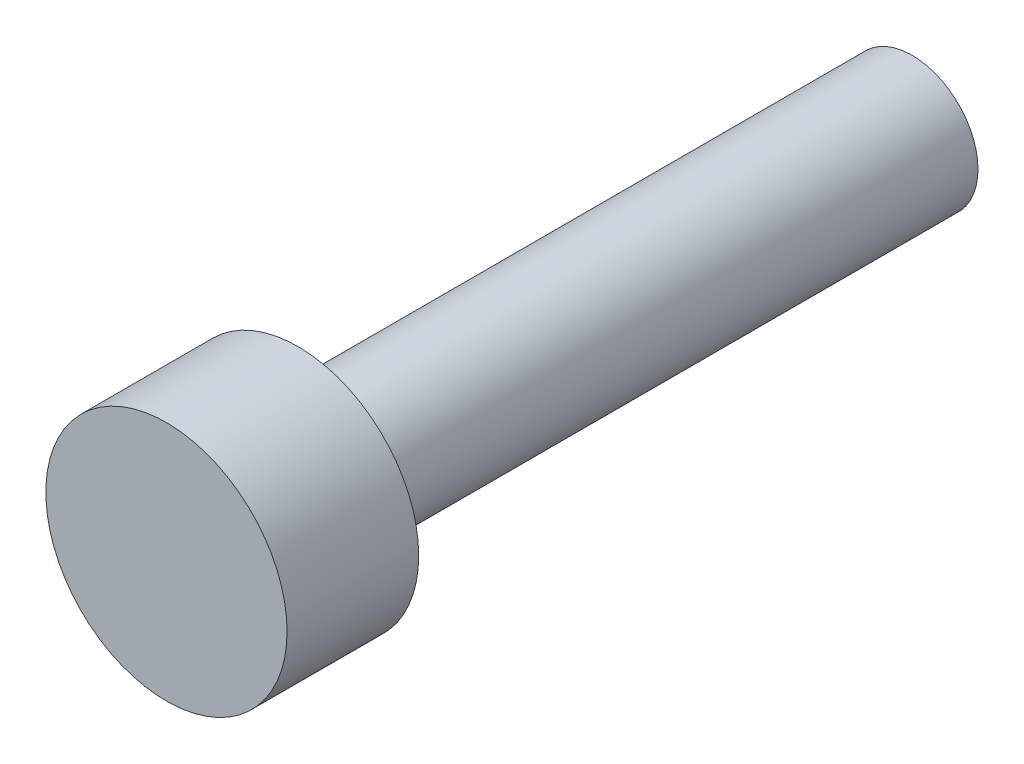
from build123d import *

# Parameters (mm, degrees)
SHANK_NOMINAL_THREAD_ENVELOPE_START     = -14
SHANK_NOMINAL_THREAD_ENVELOPE_PROFILE_R = 1.5
SHANK_NOMINAL_THREAD_ENVELOPE_DEPTH     = 14
SOCKET_HEAD_ENVELOPE_PROFILE_R          = 2.75
SOCKET_HEAD_ENVELOPE_DEPTH              = 3


with BuildPart() as part:
    # Shank_nominal_thread_envelope_profile → Shank_nominal_thread_envelope (new body)
    with BuildSketch(Plane.XY.offset(SHANK_NOMINAL_THREAD_ENVELOPE_START)):
        Circle(SHANK_NOMINAL_THREAD_ENVELOPE_PROFILE_R)
    extrude(amount=SHANK_NOMINAL_THREAD_ENVELOPE_DEPTH)

    # Socket_head_envelope_profile → Socket_head_envelope (add)
    with BuildSketch(Plane.XY):
        Circle(SOCKET_HEAD_ENVELOPE_PROFILE_R)
    extrude(amount=SOCKET_HEAD_ENVELOPE_DEPTH)


solid = part.part
